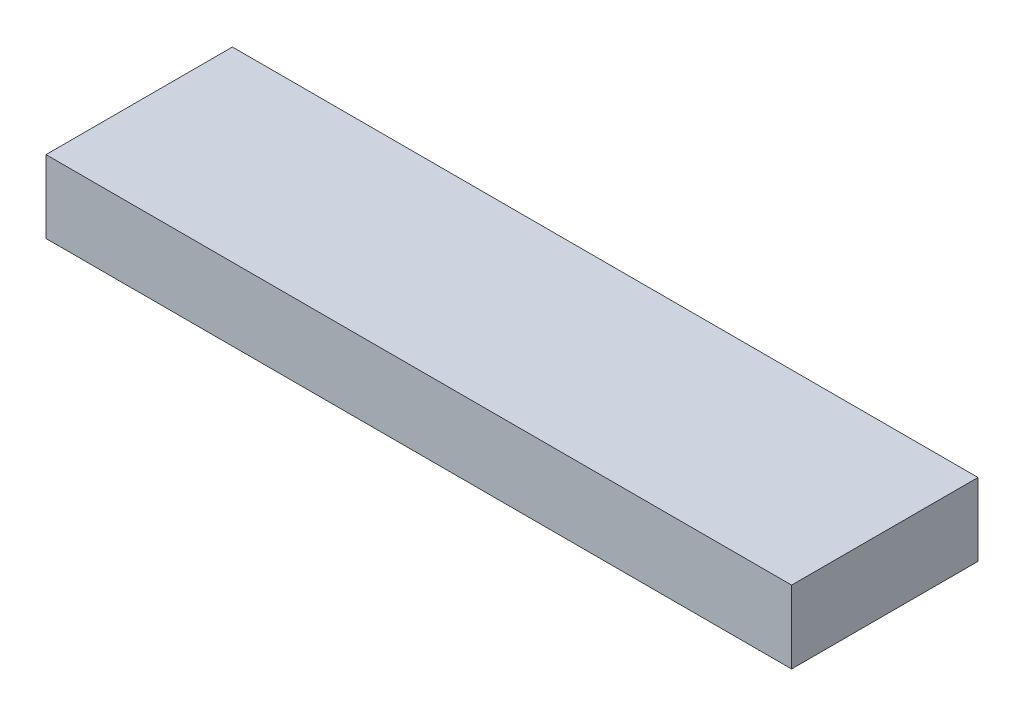
from build123d import *

# Parameters (mm, degrees)
SKETCH2_W           = 31.8
SKETCH2_H           = 7.95
BOSS_EXTRUDE1_DEPTH = 3.1
SKETCH3_W           = 28.8
SKETCH3_H           = 4.95
CUT_EXTRUDE1_DEPTH  = 2


with BuildPart() as part:
    # Sketch2 → Boss-Extrude1 (new body)
    with BuildSketch(Plane(origin=(0, 0, 0), x_dir=(1, 0, 0), z_dir=(0, 1, 0))):
        with Locations((-36.222734312, 11.173972041)):
            Rectangle(SKETCH2_W, SKETCH2_H)
    extrude(amount=BOSS_EXTRUDE1_DEPTH)

    # Sketch3 → Cut-Extrude1 (cut)
    with BuildSketch(Plane.XZ):
        with Locations((-36.222734312, -11.173972041)):
            Rectangle(SKETCH3_W, SKETCH3_H)
    extrude(amount=-CUT_EXTRUDE1_DEPTH, mode=Mode.SUBTRACT)


solid = part.part
